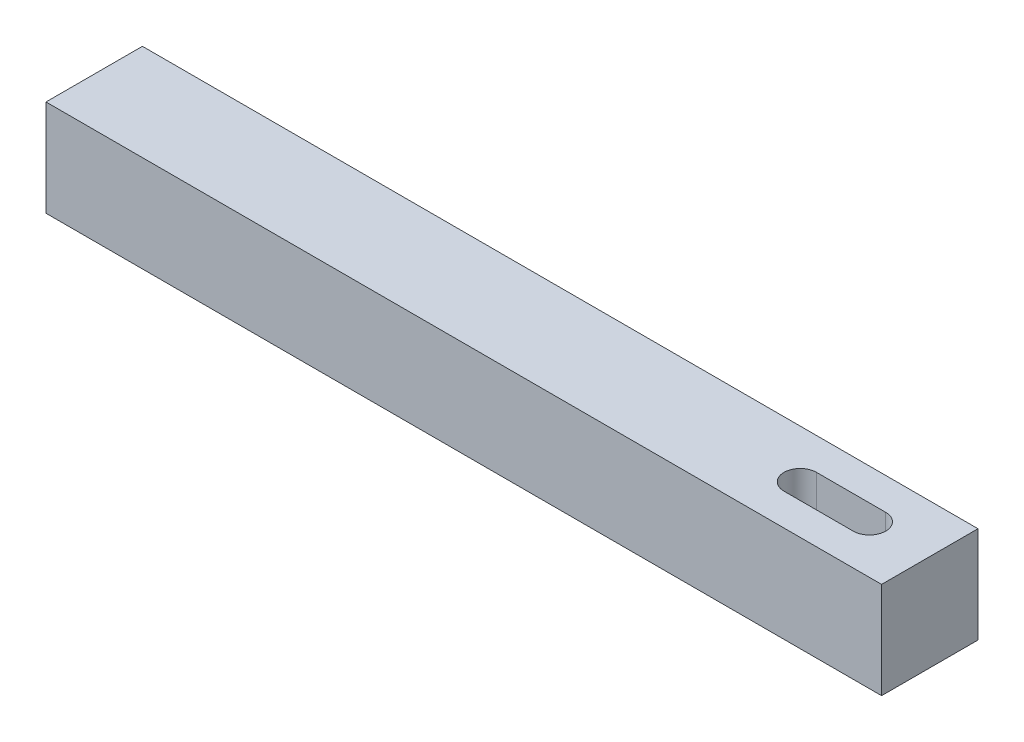
from build123d import *

# Parameters (mm, degrees)
CROQUIS1_W              = 15
CROQUIS1_H              = 15
SALIENTE_EXTRUIR1_DEPTH = 65
CORTAR_EXTRUIR1_DEPTH   = 68.12860791


with BuildPart() as part:
    # Croquis1 → Saliente-Extruir1 (new, symmetric)
    with BuildSketch(Plane(origin=(0, 0, 0), x_dir=(0, 0, -1), z_dir=(1, 0, 0))):
        Rectangle(CROQUIS1_W, CROQUIS1_H)
    extrude(amount=SALIENTE_EXTRUIR1_DEPTH, both=True)

    # Croquis2 → Cortar-Extruir1 (cut, through all)
    with BuildSketch(Plane.XZ.offset(7.5)):
        with BuildLine():
            Line((44.847129428, 2.531795375), (55.614029525, 2.531795375))
            ThreePointArc((55.614029525, 2.531795375), (58.1458249, 0), (55.614029525, -2.531795375))
            Line((55.614029525, -2.531795375), (44.847129428, -2.531795375))
            ThreePointArc((44.847129428, -2.531795375), (42.315334053, 0), (44.847129428, 2.531795375))
        make_face()
    extrude(amount=-CORTAR_EXTRUIR1_DEPTH, mode=Mode.SUBTRACT)


solid = part.part
